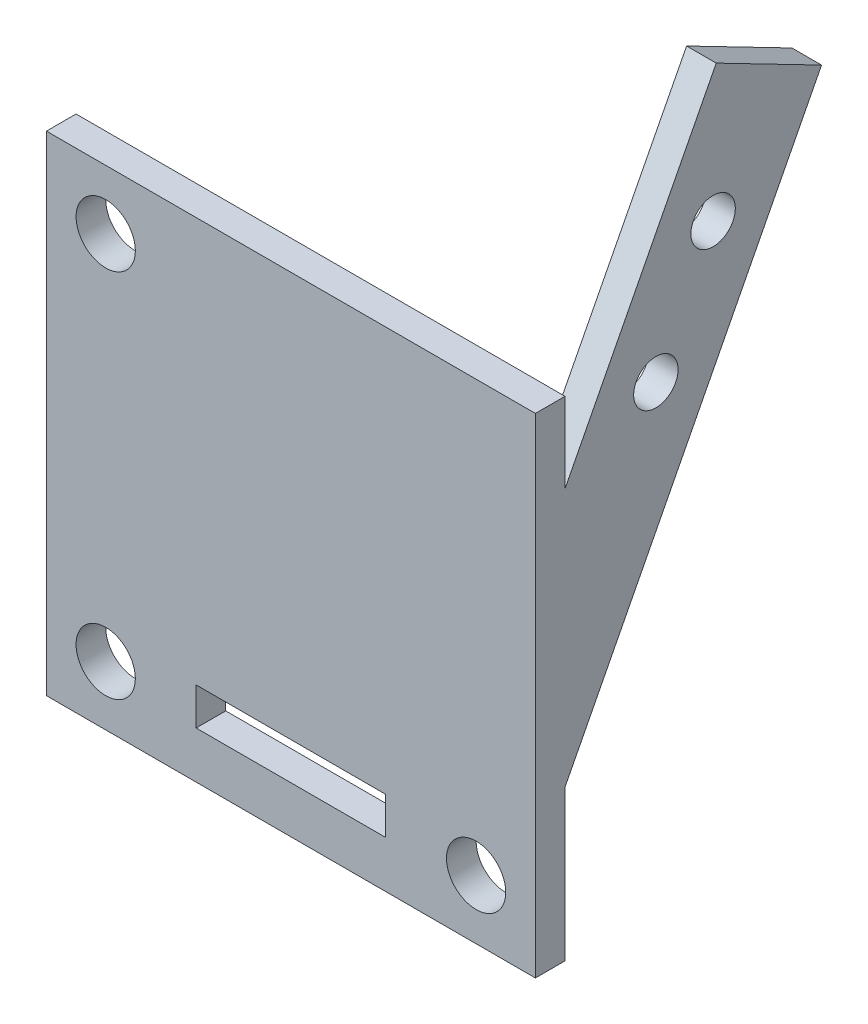
from build123d import *

# Parameters (mm, degrees)
SKETCH2_W           = 33
SKETCH2_H           = 33
BOSS_EXTRUDE1_DEPTH = 2
BOSS_EXTRUDE2_DEPTH = 2
SKETCH4_R           = 1.5
CUT_EXTRUDE1_DEPTH  = 2
SKETCH5_R           = 2
SKETCH5_W           = 12.798144854
SKETCH5_H           = 2.519841992
CUT_EXTRUDE2_DEPTH  = 2


with BuildPart() as part:
    # Sketch2 → Boss-Extrude1 (new body)
    with BuildSketch(Plane.XY):
        Rectangle(SKETCH2_W, SKETCH2_H)
    extrude(amount=BOSS_EXTRUDE1_DEPTH)

    # Sketch3 → Boss-Extrude2 (add)
    with BuildSketch(Plane(origin=(16.5, 0, 0), x_dir=(0, 0, -1), z_dir=(1, 0, 0))):
        Polygon((3.554468931, 0.544368727), (0, -6.342288665), (0, 11.100222554), (10.205017704, 30.872082142), (17.313955565, 27.202885706), align=None)
    extrude(amount=-BOSS_EXTRUDE2_DEPTH)

    # Sketch4 → Cut-Extrude1 (cut)
    with BuildSketch(Plane(origin=(16.5, 0, 0), x_dir=(0, 0, -1), z_dir=(1, 0, 0))):
        with Locations((6.13151514, 14.258559898)):
            Circle(SKETCH4_R)
        with Locations((9.994536788, 21.743027229)):
            Circle(SKETCH4_R)
    extrude(amount=-CUT_EXTRUDE1_DEPTH, mode=Mode.SUBTRACT)

    # Sketch5 → Cut-Extrude2 (cut)
    with BuildSketch(Plane(origin=(0, 0, 0), x_dir=(-1, 0, 0), z_dir=(0, 0, -1))):
        with Locations((12.5, 12.5)):
            Circle(SKETCH5_R)
        with Locations((12.5, -12.5)):
            Circle(SKETCH5_R)
        with Locations((-12.5, -12.5)):
            Circle(SKETCH5_R)
        with Locations((0, -12.077487842)):
            Rectangle(SKETCH5_W, SKETCH5_H)
    extrude(amount=-CUT_EXTRUDE2_DEPTH, mode=Mode.SUBTRACT)


solid = part.part
